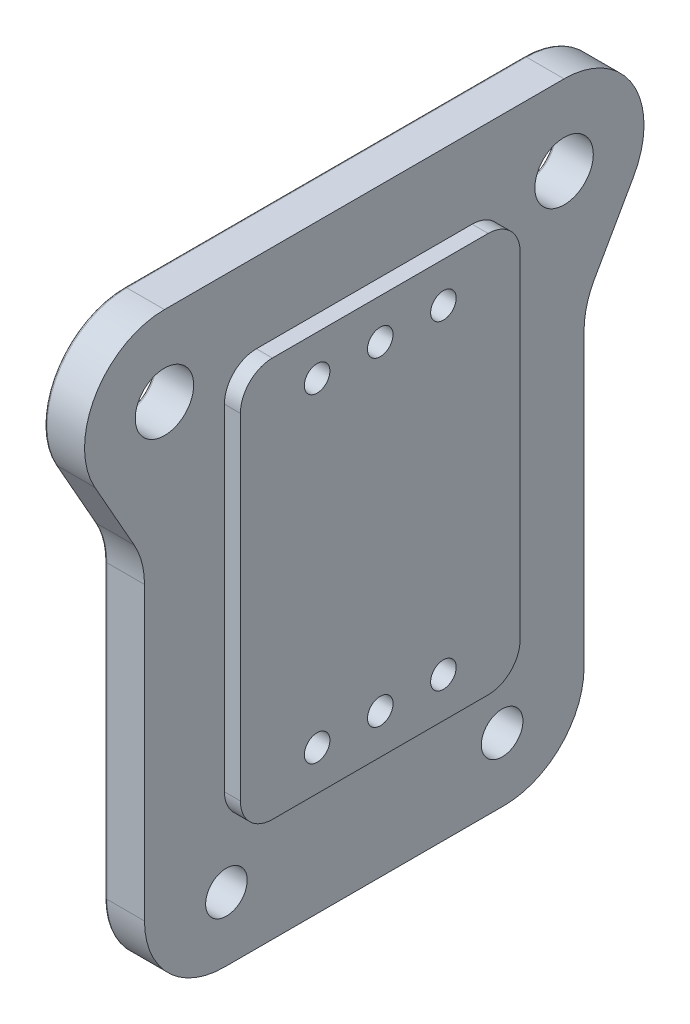
from build123d import *

# Parameters (mm, degrees)
SKETCH_2_R      = 1.6
SKETCH_2_R_2    = 2.6
SKETCH_2_R_3    = 3.655
EXTRUDE_1_DEPTH = 5
EXTRUDE_START   = 5
SKETCH_2_3_R    = 1.6
EXTRUDE_2_DEPTH = 2
FILLET_2_R      = 0.3


with BuildPart() as part:
    # Эскиз2 → Бобышка-Вытянуть1 (new body)
    with BuildSketch(Plane(origin=(0, 0, 0), x_dir=(0, 0, -1), z_dir=(1, 0, 0))):
        with BuildLine():
            ThreePointArc((-27.5, -19.44274744), (-24.571067812, -26.513815252), (-17.5, -29.44274744))
            Line((-17.5, -29.44274744), (17.5, -29.44274744))
            ThreePointArc((17.5, -29.44274744), (24.571067812, -26.513815252), (27.5, -19.44274744))
            Line((27.5, -19.44274744), (27.5, 17.024112915))
            ThreePointArc((27.5, 17.024112915), (27.828826628, 19.567418954), (28.793681122, 21.943463644))
            Line((28.793681122, 21.943463644), (33.706318878, 30.637901831))
            ThreePointArc((33.706318878, 30.637901831), (33.63694122, 40.597415886), (25, 45.55725256))
            Line((25, 45.55725256), (-25, 45.55725256))
            ThreePointArc((-25, 45.55725256), (-33.63694122, 40.597415886), (-33.706318878, 30.637901831))
            Line((-33.706318878, 30.637901831), (-28.793681122, 21.943463644))
            ThreePointArc((-28.793681122, 21.943463644), (-27.828826628, 19.567418954), (-27.5, 17.024112915))
            Line((-27.5, 17.024112915), (-27.5, -19.44274744))
        make_face()
        with Locations(Location((0, -9.44274744, 0), (0, 0, 180))):
            Circle(SKETCH_2_R, mode=Mode.SUBTRACT)
        with Locations((0, 30.55725256)):
            Circle(SKETCH_2_R, mode=Mode.SUBTRACT)
        with Locations((-17.25, -21.44274744)):
            Circle(SKETCH_2_R_2, mode=Mode.SUBTRACT)
        with Locations((-25, 35.55725256)):
            Circle(SKETCH_2_R_3, mode=Mode.SUBTRACT)
        with Locations((17.25, -21.44274744)):
            Circle(SKETCH_2_R_2, mode=Mode.SUBTRACT)
        with Locations((25, 35.55725256)):
            Circle(SKETCH_2_R_3, mode=Mode.SUBTRACT)
        with Locations((-7.9, -9.44274744)):
            Circle(SKETCH_2_R, mode=Mode.SUBTRACT)
        with Locations((-7.9, 30.55725256)):
            Circle(SKETCH_2_R, mode=Mode.SUBTRACT)
        with Locations((7.9, -9.44274744)):
            Circle(SKETCH_2_R, mode=Mode.SUBTRACT)
        with Locations((7.9, 30.55725256)):
            Circle(SKETCH_2_R, mode=Mode.SUBTRACT)
    extrude(amount=EXTRUDE_1_DEPTH)

    # Эскиз2<3> → Бобышка-Вытянуть2 (add)
    with BuildSketch(Plane(origin=(0, 0, 0), x_dir=(0, 0, -1), z_dir=(1, 0, 0)).offset(EXTRUDE_START)):
        with BuildLine():
            Line((-13.5, -14.44274744), (13.5, -14.44274744))
            ThreePointArc((13.5, -14.44274744), (16.328427125, -13.271174565), (17.5, -10.44274744))
            Line((17.5, -10.44274744), (17.5, 31.55725256))
            ThreePointArc((17.5, 31.55725256), (16.328427125, 34.385679684), (13.5, 35.55725256))
            Line((13.5, 35.55725256), (-13.5, 35.55725256))
            ThreePointArc((-13.5, 35.55725256), (-16.328427125, 34.385679684), (-17.5, 31.55725256))
            Line((-17.5, 31.55725256), (-17.5, -10.44274744))
            ThreePointArc((-17.5, -10.44274744), (-16.328427125, -13.271174565), (-13.5, -14.44274744))
        make_face()
        with Locations((0, 30.55725256)):
            Circle(SKETCH_2_3_R, mode=Mode.SUBTRACT)
        with Locations(Location((0, -9.44274744, 0), (0, 0, 180))):
            Circle(SKETCH_2_3_R, mode=Mode.SUBTRACT)
        with Locations((-7.9, -9.44274744)):
            Circle(SKETCH_2_3_R, mode=Mode.SUBTRACT)
        with Locations((-7.9, 30.55725256)):
            Circle(SKETCH_2_3_R, mode=Mode.SUBTRACT)
        with Locations((7.9, -9.44274744)):
            Circle(SKETCH_2_3_R, mode=Mode.SUBTRACT)
        with Locations((7.9, 30.55725256)):
            Circle(SKETCH_2_3_R, mode=Mode.SUBTRACT)
    extrude(amount=EXTRUDE_2_DEPTH)

    # Скругление2
    fillet_2_edges = [part.edges().sort_by_distance(p)[0] for p in [
        (0, 19.567418954, 27.828826628),
        (0, 26.290682737, 31.25),
        (0, 40.597415886, 33.63694122),
        (0, 45.55725256, 0),
        (0, 40.597415886, -33.63694122),
        (0, 26.290682737, -31.25),
        (0, 19.567418954, -27.828826628),
        (0, -1.209317263, -27.5),
        (0, -26.513815252, -24.571067812),
        (0, -29.44274744, 0),
        (0, -26.513815252, 24.571067812),
        (0, -1.209317263, 27.5),
        (0, 35.55725256, -21.345),
        (0, 35.55725256, 28.655),
        (0, -21.44274744, 19.85),
        (0, -21.44274744, -14.65),
    ]]
    fillet(fillet_2_edges, radius=FILLET_2_R)


solid = part.part
